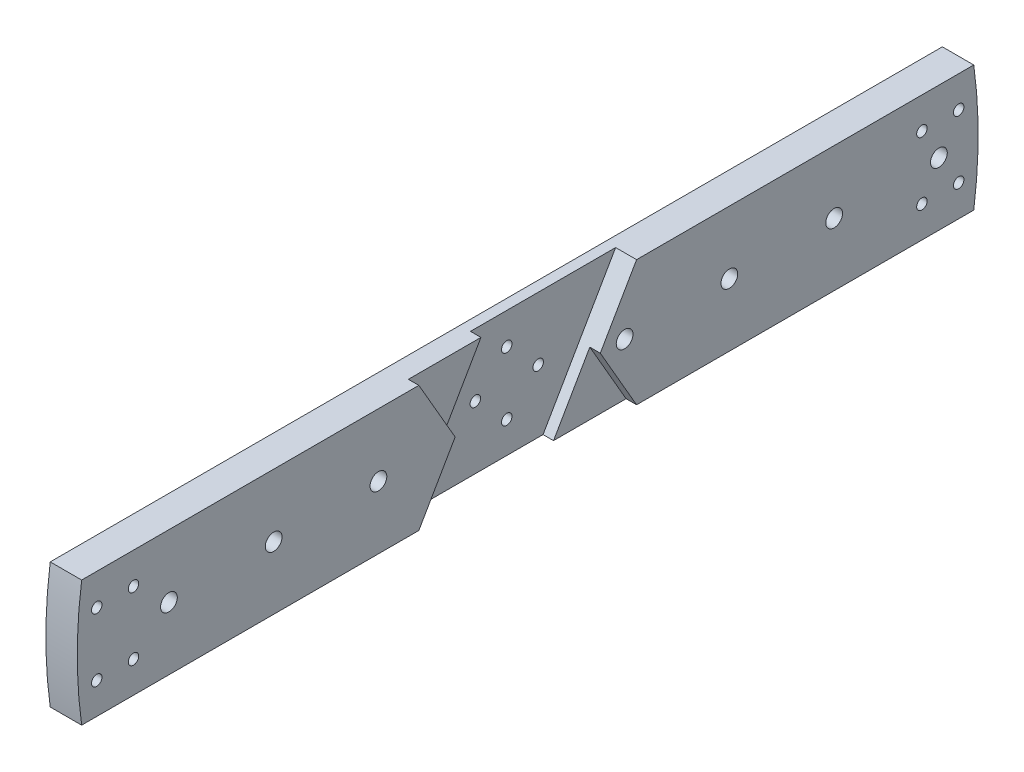
from build123d import *

# Parameters (mm, degrees)
SKETCH2_R           = 3.175
SKETCH2_R_2         = 5.08
BOSS_EXTRUDE1_DEPTH = 19.05
CUT_EXTRUDE1_START  = -12.7
SKETCH3_R           = 3.175
CUT_EXTRUDE1_DEPTH  = 12.7
CUT_EXTRUDE2_DEPTH  = 6.35


with BuildPart() as part:
    # Sketch2 → Boss-Extrude1 (new body)
    with BuildSketch(Plane(origin=(0, 0, 0), x_dir=(0, 0, -1), z_dir=(1, 0, 0))):
        with BuildLine():
            Line((38.1, 38.1), (-270.378794472, 38.1))
            ThreePointArc((-270.378794472, 38.1), (-273.05, 0), (-270.378794472, -38.1))
            Line((-270.378794472, -38.1), (270.378794472, -38.1))
            ThreePointArc((270.378794472, -38.1), (273.05, 0), (270.378794472, 38.1))
            Line((270.378794472, 38.1), (38.1, 38.1))
        make_face()
        with Locations((19.05, 0)):
            Circle(SKETCH2_R, mode=Mode.SUBTRACT)
        with Locations((0, -19.05)):
            Circle(SKETCH2_R, mode=Mode.SUBTRACT)
        with Locations((-19.05, 0)):
            Circle(SKETCH2_R, mode=Mode.SUBTRACT)
        with Locations((0, 19.05)):
            Circle(SKETCH2_R, mode=Mode.SUBTRACT)
        with Locations((-90.4875, 0)):
            Circle(SKETCH2_R_2, mode=Mode.SUBTRACT)
        with Locations((-217.4875, 0)):
            Circle(SKETCH2_R_2, mode=Mode.SUBTRACT)
        with Locations((-153.9875, 0)):
            Circle(SKETCH2_R_2, mode=Mode.SUBTRACT)
        with Locations((185.7375, 0)):
            Circle(SKETCH2_R_2, mode=Mode.SUBTRACT)
        with Locations((58.7375, 0)):
            Circle(SKETCH2_R_2, mode=Mode.SUBTRACT)
        with Locations((122.2375, 0)):
            Circle(SKETCH2_R_2, mode=Mode.SUBTRACT)
        with Locations((-238.949490115, 19.110830171)):
            Circle(SKETCH2_R, mode=Mode.SUBTRACT)
        with Locations((-261.240141142, -19.100852393)):
            Circle(SKETCH2_R, mode=Mode.SUBTRACT)
        with Locations((-238.949490115, -19.110830171)):
            Circle(SKETCH2_R, mode=Mode.SUBTRACT)
        with Locations((-261.240141142, 19.100852393)):
            Circle(SKETCH2_R, mode=Mode.SUBTRACT)
        with Locations((261.240141142, 19.100852393)):
            Circle(SKETCH2_R, mode=Mode.SUBTRACT)
        with Locations((238.949490115, 19.110830171)):
            Circle(SKETCH2_R, mode=Mode.SUBTRACT)
        with Locations((249.2375, 0)):
            Circle(SKETCH2_R_2, mode=Mode.SUBTRACT)
        with Locations((238.949490115, -19.110830171)):
            Circle(SKETCH2_R, mode=Mode.SUBTRACT)
        with Locations((261.240141142, -19.100852393)):
            Circle(SKETCH2_R, mode=Mode.SUBTRACT)
    extrude(amount=BOSS_EXTRUDE1_DEPTH)

    # Sketch3 → Cut-Extrude1 (cut)
    with BuildSketch(Plane(origin=(19.05, 0, 0), x_dir=(0, 0, -1), z_dir=(1, 0, 0)).offset(CUT_EXTRUDE1_START)):
        Polygon((21.997045256, -38.1), (65.991135768, 38.1), (-21.997045256, 38.1), (-65.991135768, -38.1), align=None)
        with Locations((-19.05, 0)):
            Circle(SKETCH3_R, mode=Mode.SUBTRACT)
        with Locations((0, -19.05)):
            Circle(SKETCH3_R, mode=Mode.SUBTRACT)
        with Locations((19.05, 0)):
            Circle(SKETCH3_R, mode=Mode.SUBTRACT)
        with Locations((0, 19.05)):
            Circle(SKETCH3_R, mode=Mode.SUBTRACT)
    extrude(amount=CUT_EXTRUDE1_DEPTH, mode=Mode.SUBTRACT)

    # Sketch3<3> → Cut-Extrude2 (cut)
    with BuildSketch(Plane(origin=(19.05, 0, 0), x_dir=(0, 0, -1), z_dir=(1, 0, 0))):
        Polygon((21.997045256, -38.1), (65.991135768, -38.1), (43.994090512, 0), align=None)
        Polygon((-43.994090512, 0), (-21.997045256, 38.1), (-65.991135768, 38.1), align=None)
    extrude(amount=-CUT_EXTRUDE2_DEPTH, mode=Mode.SUBTRACT)


solid = part.part
